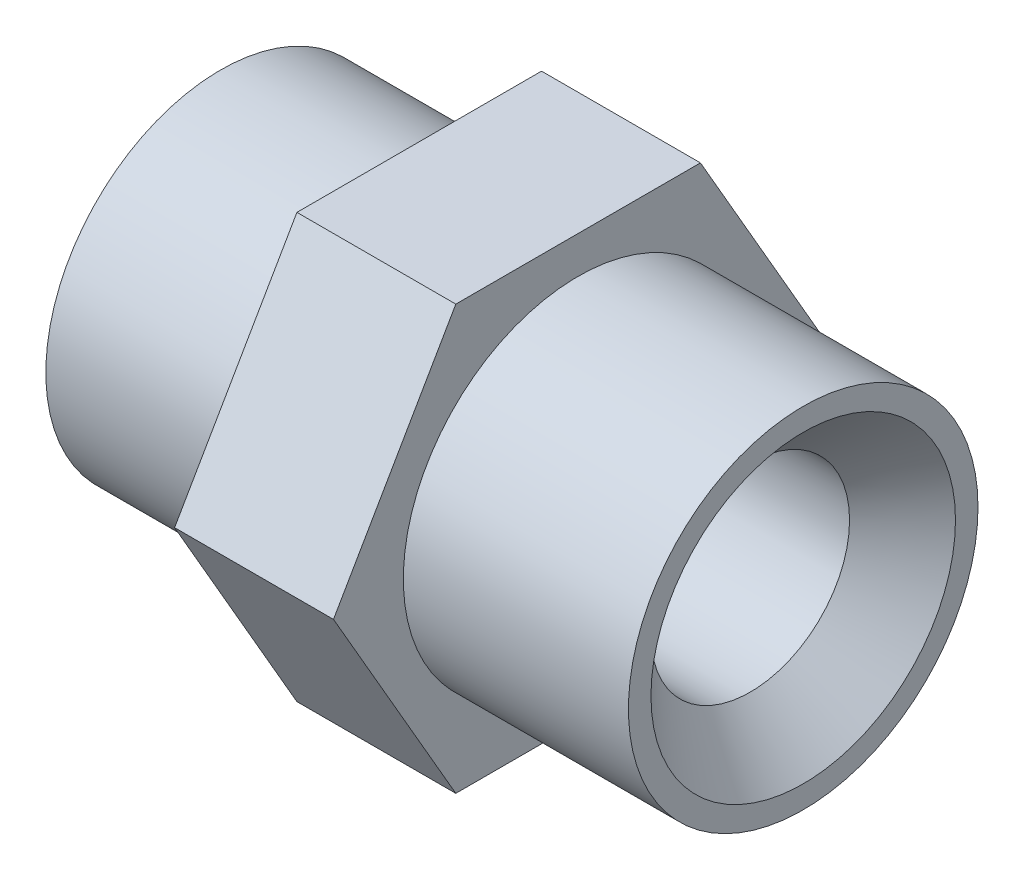
from build123d import *

# Parameters (mm, degrees)
SZKIC1_R                    = 13.2
SZKIC1_R_2                  = 7.5
DODANIE_WYCI_GNI_CIE1_DEPTH = 44
DODANIE_WYCI_GNI_CIE2_DEPTH = 12
SFAZOWANIE1_SIZE            = 4
SZKIC8_R                    = 7.5
WYTNIJ_WYCI_GNI_CIE1_DEPTH  = 12
SFAZOWANIE2_SIZE            = 4


with BuildPart() as part:
    # Szkic1 → Dodanie-wyciągnięcie1 (new body)
    with BuildSketch(Plane(origin=(0, 0, 0), x_dir=(0, 0, -1), z_dir=(1, 0, 0))):
        Circle(SZKIC1_R)
        Circle(SZKIC1_R_2, mode=Mode.SUBTRACT)
    extrude(amount=DODANIE_WYCI_GNI_CIE1_DEPTH)

    # Szkic6 → Dodanie-wyciągnięcie2 (add)
    with BuildSketch(Plane(origin=(15, 0, 0), x_dir=(0, 0, -1), z_dir=(1, 0, 0))):
        Polygon((18.475208614, 0), (9.237604307, 16), (-9.237604307, 16), (-18.475208614, 0), (-9.237604307, -16), (9.237604307, -16), align=None)
    extrude(amount=DODANIE_WYCI_GNI_CIE2_DEPTH)

    # Sfazowanie1
    sfazowanie1_edges = [part.edges().sort_by_distance(p)[0] for p in [
        (44, 0, 7.5),
    ]]
    chamfer(sfazowanie1_edges, length=SFAZOWANIE1_SIZE)

    # Szkic8 → Wytnij-wyciągnięcie1 (cut)
    with BuildSketch(Plane.ZY.offset(-15)):
        with Locations(Location((0, 0, 0), (0, 0, 180))):
            Circle(SZKIC8_R)
    extrude(amount=-WYTNIJ_WYCI_GNI_CIE1_DEPTH, mode=Mode.SUBTRACT)

    # Sfazowanie2
    sfazowanie2_edges = [part.edges().sort_by_distance(p)[0] for p in [
        (0, 0, 7.5),
    ]]
    chamfer(sfazowanie2_edges, length=SFAZOWANIE2_SIZE)


solid = part.part
